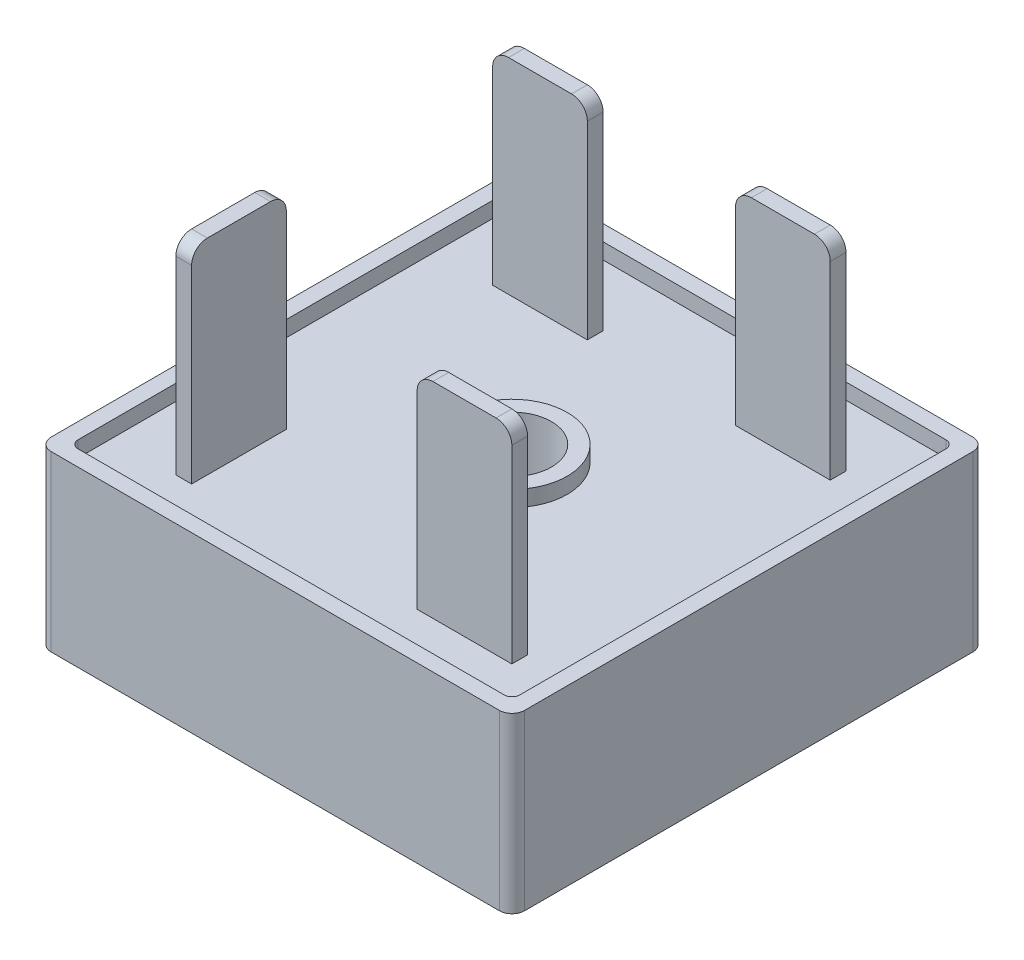
from build123d import *

# Parameters (mm, degrees)
SKETCH1_R           = 2.5
BOSS_EXTRUDE1_DEPTH = 11
SKETCH2_R           = 3.5
CUT_EXTRUDE1_DEPTH  = 1
SKETCH3_W           = 6
SKETCH3_H           = 1
SKETCH3_W_2         = 1
SKETCH3_H_2         = 6
BOSS_EXTRUDE2_DEPTH = 13
FILLET1_R           = 1


with BuildPart() as part:
    # Sketch1 → Boss-Extrude1 (new body)
    with BuildSketch(Plane(origin=(0, 0, 0), x_dir=(1, 0, 0), z_dir=(0, 1, 0))):
        with BuildLine():
            Line((-22.081775976, 18.25540597), (6.318224024, 18.25540597))
            ThreePointArc((6.318224024, 18.25540597), (6.883909449, 18.021091395), (7.118224024, 17.45540597))
            Line((7.118224024, 17.45540597), (7.118224024, -10.94459403))
            ThreePointArc((7.118224024, -10.94459403), (6.883909449, -11.510279455), (6.318224024, -11.74459403))
            Line((6.318224024, -11.74459403), (-22.081775976, -11.74459403))
            ThreePointArc((-22.081775976, -11.74459403), (-22.647461401, -11.510279455), (-22.881775976, -10.94459403))
            Line((-22.881775976, -10.94459403), (-22.881775976, 17.45540597))
            ThreePointArc((-22.881775976, 17.45540597), (-22.647461401, 18.021091395), (-22.081775976, 18.25540597))
        make_face()
        with Locations(Location((-7.881775976, 3.25540597, 0), (0, 0, 270))):
            Circle(SKETCH1_R, mode=Mode.SUBTRACT)
    extrude(amount=BOSS_EXTRUDE1_DEPTH)

    # Sketch2 → Cut-Extrude1 (cut)
    with BuildSketch(Plane(origin=(0, 11, 0), x_dir=(1, 0, 0), z_dir=(0, 1, 0))):
        with BuildLine():
            Line((-21.381775976, 17.25540597), (5.618224024, 17.25540597))
            ThreePointArc((5.618224024, 17.25540597), (5.971777415, 17.108959361), (6.118224024, 16.75540597))
            Line((6.118224024, 16.75540597), (6.118224024, -10.24459403))
            ThreePointArc((6.118224024, -10.24459403), (5.971777415, -10.598147421), (5.618224024, -10.74459403))
            Line((5.618224024, -10.74459403), (-21.381775976, -10.74459403))
            ThreePointArc((-21.381775976, -10.74459403), (-21.735329367, -10.598147421), (-21.881775976, -10.24459403))
            Line((-21.881775976, -10.24459403), (-21.881775976, 16.75540597))
            ThreePointArc((-21.881775976, 16.75540597), (-21.735329367, 17.108959361), (-21.381775976, 17.25540597))
        make_face()
        with Locations(Location((-7.881775976, 3.25540597, 0), (0, 0, 270))):
            Circle(SKETCH2_R, mode=Mode.SUBTRACT)
    extrude(amount=-CUT_EXTRUDE1_DEPTH, mode=Mode.SUBTRACT)

    # Sketch3 → Boss-Extrude2 (add)
    with BuildSketch(Plane(origin=(0, 10, 0), x_dir=(1, 0, 0), z_dir=(0, 1, 0))):
        with Locations((-15.224035156, 12.872185426)):
            Rectangle(SKETCH3_W, SKETCH3_H)
        with Locations((0.167819541, 12.872185426)):
            Rectangle(SKETCH3_W, SKETCH3_H)
        with Locations((0.167819541, -7.304488602)):
            Rectangle(SKETCH3_W, SKETCH3_H)
        with Locations((-17.353346933, -5.074456638)):
            Rectangle(SKETCH3_W_2, SKETCH3_H_2)
    extrude(amount=BOSS_EXTRUDE2_DEPTH)

    # Fillet1
    fillet1_edges = [part.edges().sort_by_distance(p)[0] for p in [
        (-18.224035156, 23, -12.872185426),
        (-12.224035156, 23, -12.872185426),
        (-2.832180459, 23, -12.872185426),
        (3.167819541, 23, -12.872185426),
        (-2.832180459, 23, 7.304488602),
        (3.167819541, 23, 7.304488602),
        (-17.353346933, 23, 8.074456638),
        (-17.353346933, 23, 2.074456638),
    ]]
    fillet(fillet1_edges, radius=FILLET1_R)


solid = part.part
